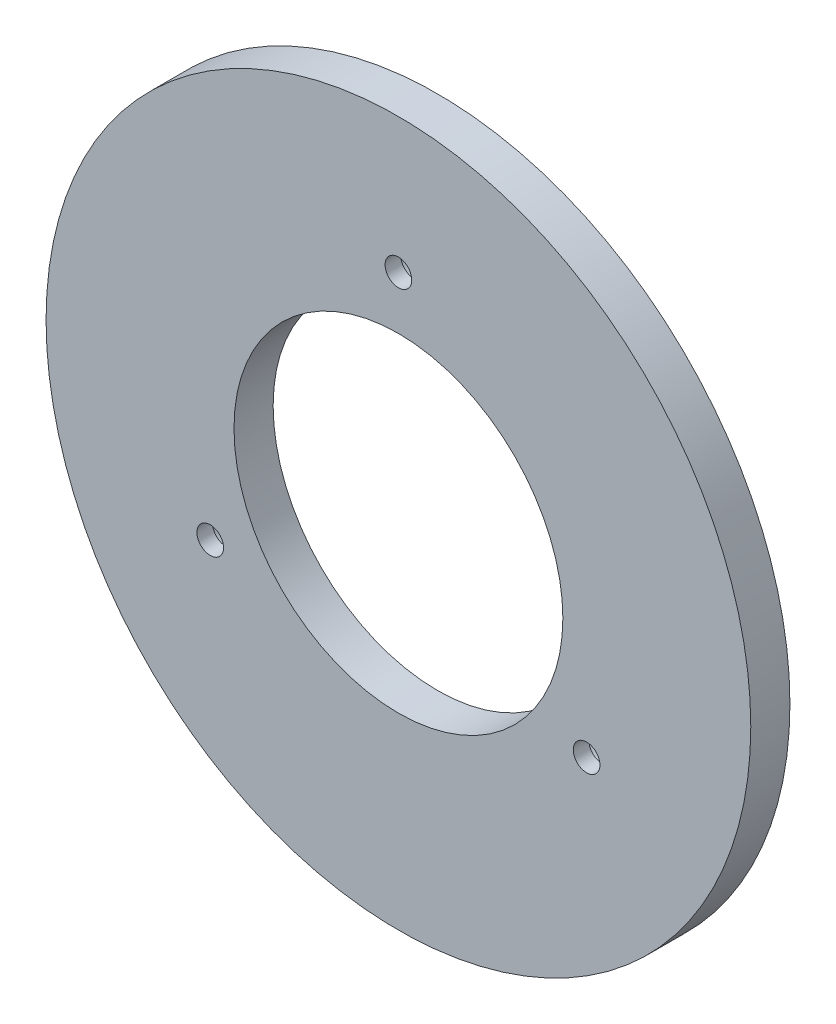
from build123d import *

# Parameters (mm, degrees)
CROQUIS1_R                   = 45
CROQUIS1_R_2                 = 21
SALIENTE_EXTRUIR1_DEPTH      = 5
TALADRO_DE_MARGEN_PARA_M31_D = 3.4
CROQUIS4_R                   = 3.2
CORTAR_EXTRUIR1_DEPTH        = 3


with BuildPart() as part:
    # Croquis1 → Saliente-Extruir1 (new body)
    with BuildSketch(Plane.XY):
        Circle(CROQUIS1_R)
        Circle(CROQUIS1_R_2, mode=Mode.SUBTRACT)
    extrude(amount=SALIENTE_EXTRUIR1_DEPTH)

    # Taladro de margen para M31 (through all)
    with Locations(Plane(origin=(0, 0, 0), x_dir=(-1, 0, 0), z_dir=(0, 0, -1))):
        with Locations((0, 27.75), (24.032204955, -13.875), (-24.032204955, -13.875)):
            Hole(TALADRO_DE_MARGEN_PARA_M31_D / 2)

    # Croquis4 → Cortar-Extruir1 (cut)
    with BuildSketch(Plane(origin=(0, 0, 0), x_dir=(-1, 0, 0), z_dir=(0, 0, -1))):
        with Locations((0, 27.75)):
            Circle(CROQUIS4_R)
        with Locations((23.382685902, -13.5)):
            Circle(CROQUIS4_R)
        with Locations((-24.032204955, -13.125)):
            Circle(CROQUIS4_R)
    extrude(amount=-CORTAR_EXTRUIR1_DEPTH, mode=Mode.SUBTRACT)


solid = part.part
